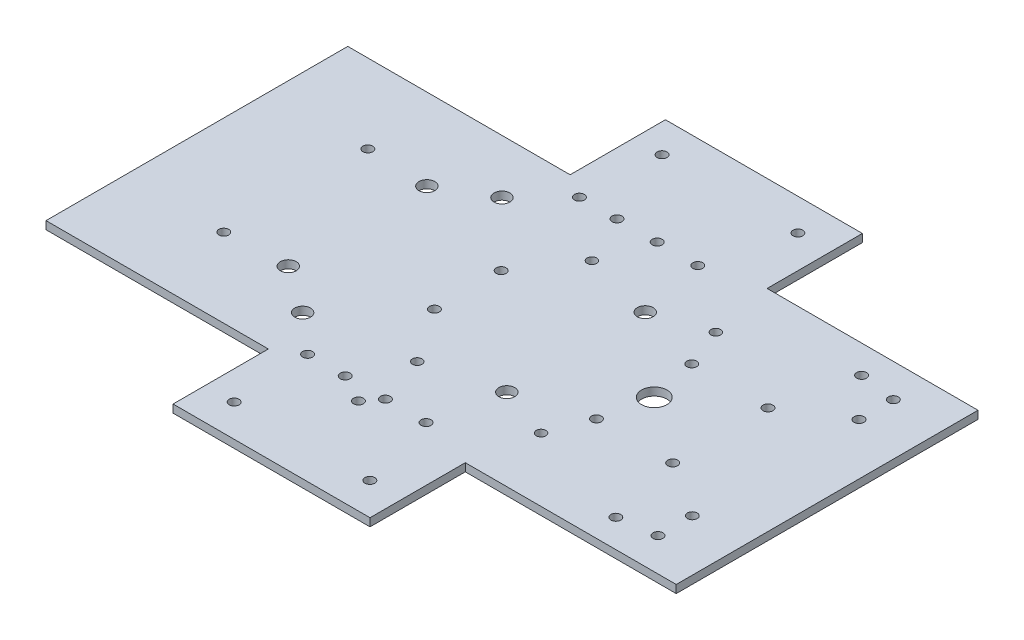
from build123d import *

# Parameters (mm, degrees)
SKETCH_1_R      = 1.5
SKETCH_1_R_2    = 4
SKETCH_1_R_3    = 2.5
SKETCH_1_R_4    = 1.55
EXTRUDE_1_DEPTH = 2.5


with BuildPart() as part:
    # 草图1 → 凸台-拉伸1 (new body)
    with BuildSketch(Plane(origin=(0, 0, 0), x_dir=(1, 0, 0), z_dir=(0, 1, 0))):
        Polygon((0, 95), (70, 95), (70, 125), (132, 125), (132, 95), (198.395701384, 95), (198.395701384, 0), (132, 0), (132, -30), (70, -30), (70, 0), (0, 0), align=None)
        with Locations(Location((96.855482095, 20, 0), (0, 0, 270))):
            Circle(SKETCH_1_R, mode=Mode.SUBTRACT)
        with Locations(Location((135.855482095, 20, 0), (0, 0, 270))):
            Circle(SKETCH_1_R, mode=Mode.SUBTRACT)
        with Locations(Location((96.855482095, 75, 0), (0, 0, 270))):
            Circle(SKETCH_1_R, mode=Mode.SUBTRACT)
        with Locations(Location((135.855482095, 75, 0), (0, 0, 270))):
            Circle(SKETCH_1_R, mode=Mode.SUBTRACT)
        with Locations(Location((143.91825516, 47.568677235, 0), (0, 0, 270))):
            Circle(SKETCH_1_R_2, mode=Mode.SUBTRACT)
        with Locations(Location((65.477875917, 15.309382071, 0), (0, 0, 270))):
            Circle(SKETCH_1_R_3, mode=Mode.SUBTRACT)
        with Locations(Location((65.477875917, 78.060864371, 0), (0, 0, 270))):
            Circle(SKETCH_1_R_3, mode=Mode.SUBTRACT)
        with Locations(Location((50.549464097, 69.348606616, 0), (0, 0, 270))):
            Circle(SKETCH_1_R_3, mode=Mode.SUBTRACT)
        with Locations(Location((119.28195754, 69.348606616, 0), (0, 0, 270))):
            Circle(SKETCH_1_R_3, mode=Mode.SUBTRACT)
        with Locations(Location((85.282184512, 58, 0), (0, 0, 270))):
            Circle(SKETCH_1_R_4, mode=Mode.SUBTRACT)
        with Locations(Location((85.282184512, 37, 0), (0, 0, 270))):
            Circle(SKETCH_1_R_4, mode=Mode.SUBTRACT)
        with Locations(Location((119.302755352, 25.765245087, 0), (0, 0, 270))):
            Circle(SKETCH_1_R_3, mode=Mode.SUBTRACT)
        with Locations(Location((50.570293212, 25.699647342, 0), (0, 0, 270))):
            Circle(SKETCH_1_R_3, mode=Mode.SUBTRACT)
        with Locations(Location((140.705086193, 62.572870277, 0), (0, 0, 270))):
            Circle(SKETCH_1_R_4, mode=Mode.SUBTRACT)
        with Locations(Location((164.705086193, 62.572870277, 0), (0, 0, 270))):
            Circle(SKETCH_1_R_4, mode=Mode.SUBTRACT)
        with Locations(Location((140.705086193, 32.572870277, 0), (0, 0, 270))):
            Circle(SKETCH_1_R_4, mode=Mode.SUBTRACT)
        with Locations(Location((164.705086193, 32.572870277, 0), (0, 0, 270))):
            Circle(SKETCH_1_R_4, mode=Mode.SUBTRACT)
        with Locations(Location((79.074216313, -19.848364995, 0), (0, 0, 270))):
            Circle(SKETCH_1_R_4, mode=Mode.SUBTRACT)
        with Locations(Location((121.803446989, -19.848364995, 0), (0, 0, 270))):
            Circle(SKETCH_1_R_4, mode=Mode.SUBTRACT)
        with Locations(Location((79.009903556, 114.923802126, 0), (0, 0, 270))):
            Circle(SKETCH_1_R_4, mode=Mode.SUBTRACT)
        with Locations(Location((121.739114772, 114.964582564, 0), (0, 0, 270))):
            Circle(SKETCH_1_R_4, mode=Mode.SUBTRACT)
        with Locations(Location((31.137813249, 24.825739094, 0), (0, 0, 270))):
            Circle(SKETCH_1_R_4, mode=Mode.SUBTRACT)
        with Locations(Location((31.116158933, 70.203968261, 0), (0, 0, 270))):
            Circle(SKETCH_1_R_4, mode=Mode.SUBTRACT)
        with Locations(Location((77.583731052, 90.347159974, 0), (0, 0, 270))):
            Circle(SKETCH_1_R_4, mode=Mode.SUBTRACT)
        with Locations(Location((89.406896358, 90.347159974, 0), (0, 0, 270))):
            Circle(SKETCH_1_R_4, mode=Mode.SUBTRACT)
        with Locations(Location((98.355349988, 0, 0), (0, 0, 270))):
            Circle(SKETCH_1_R_4, mode=Mode.SUBTRACT)
        with Locations(Location((102.054410992, 90.347159974, 0), (0, 0, 270))):
            Circle(SKETCH_1_R_4, mode=Mode.SUBTRACT)
        with Locations(Location((114.840909304, 90.347159974, 0), (0, 0, 270))):
            Circle(SKETCH_1_R_4, mode=Mode.SUBTRACT)
        with Locations(Location((114.88174999, 4.762462791, 0), (0, 0, 270))):
            Circle(SKETCH_1_R_4, mode=Mode.SUBTRACT)
        with Locations(Location((102.095257502, 4.750259459, 0), (0, 0, 270))):
            Circle(SKETCH_1_R_4, mode=Mode.SUBTRACT)
        with Locations(Location((89.447748628, 4.738188772, 0), (0, 0, 270))):
            Circle(SKETCH_1_R_4, mode=Mode.SUBTRACT)
        with Locations(Location((77.624588706, 4.726904837, 0), (0, 0, 270))):
            Circle(SKETCH_1_R_4, mode=Mode.SUBTRACT)
        with Locations(Location((170.569167864, 86.187416053, 0), (0, 0, 270))):
            Circle(SKETCH_1_R_4, mode=Mode.SUBTRACT)
        with Locations(Location((182.194893719, 84.546137109, 0), (0, 0, 270))):
            Circle(SKETCH_1_R_4, mode=Mode.SUBTRACT)
        with Locations(Location((182.194893719, 73.741050727, 0), (0, 0, 270))):
            Circle(SKETCH_1_R_4, mode=Mode.SUBTRACT)
        with Locations(Location((182.194893719, 21.258949273, 0), (0, 0, 270))):
            Circle(SKETCH_1_R_4, mode=Mode.SUBTRACT)
        with Locations(Location((182.194893719, 10.453862891, 0), (0, 0, 270))):
            Circle(SKETCH_1_R_4, mode=Mode.SUBTRACT)
        with Locations(Location((170.569167864, 8.812583947, 0), (0, 0, 270))):
            Circle(SKETCH_1_R_4, mode=Mode.SUBTRACT)
    extrude(amount=EXTRUDE_1_DEPTH)


solid = part.part
